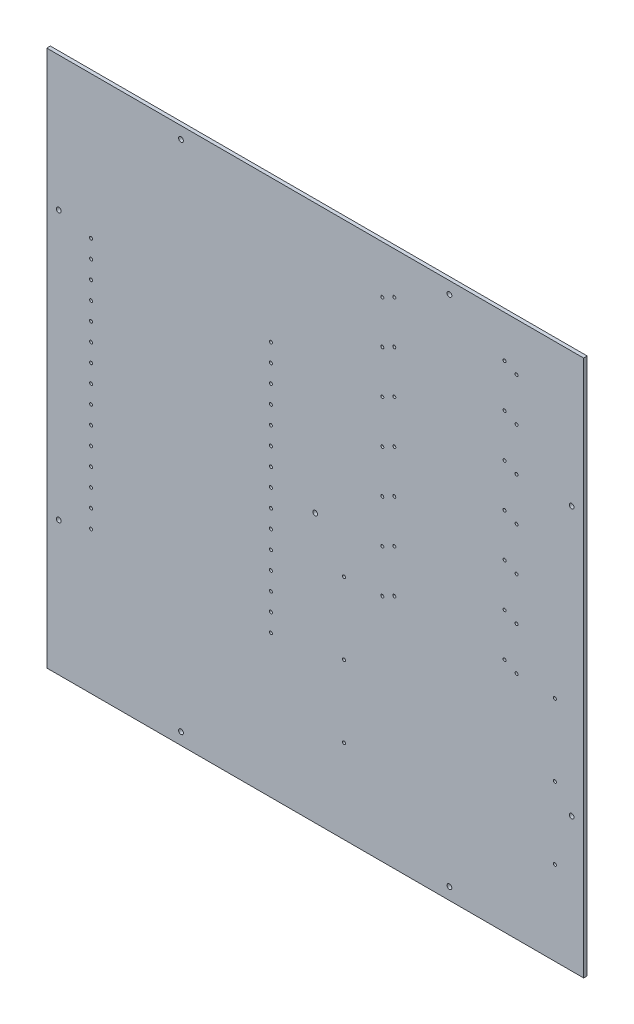
from build123d import *

# Parameters (mm, degrees)
SCHIZZO1_W                   = 448
SCHIZZO1_H                   = 448
SCHIZZO1_R                   = 2
SCHIZZO1_R_2                 = 1.25
ESTRUSIONE_ESTRUSIONE1_DEPTH = 3


with BuildPart() as part:
    # Schizzo1 → Estrusione-Estrusione1 (new body)
    with BuildSketch(Plane.XY):
        with Locations((224, 224)):
            Rectangle(SCHIZZO1_W, SCHIZZO1_H)
        with Locations((10, 336)):
            Circle(SCHIZZO1_R, mode=Mode.SUBTRACT)
        with Locations(Location((336, 438, 0), (0, 0, 180))):
            Circle(SCHIZZO1_R, mode=Mode.SUBTRACT)
        with Locations(Location((438, 336, 0), (0, 0, 180))):
            Circle(SCHIZZO1_R, mode=Mode.SUBTRACT)
        with Locations((438, 112)):
            Circle(SCHIZZO1_R, mode=Mode.SUBTRACT)
        with Locations((336, 10)):
            Circle(SCHIZZO1_R, mode=Mode.SUBTRACT)
        with Locations(Location((112, 10, 0), (0, 0, 180))):
            Circle(SCHIZZO1_R, mode=Mode.SUBTRACT)
        with Locations(Location((10, 112, 0), (0, 0, 180))):
            Circle(SCHIZZO1_R, mode=Mode.SUBTRACT)
        with Locations((36.958788995, 224)):
            Circle(SCHIZZO1_R_2, mode=Mode.SUBTRACT)
        with Locations((112, 438)):
            Circle(SCHIZZO1_R, mode=Mode.SUBTRACT)
        with Locations((36.958788995, 239)):
            Circle(SCHIZZO1_R_2, mode=Mode.SUBTRACT)
        with Locations((36.958788995, 254)):
            Circle(SCHIZZO1_R_2, mode=Mode.SUBTRACT)
        with Locations((36.958788995, 269)):
            Circle(SCHIZZO1_R_2, mode=Mode.SUBTRACT)
        with Locations((36.958788995, 284)):
            Circle(SCHIZZO1_R_2, mode=Mode.SUBTRACT)
        with Locations((36.958788995, 299)):
            Circle(SCHIZZO1_R_2, mode=Mode.SUBTRACT)
        with Locations((36.958788995, 314)):
            Circle(SCHIZZO1_R_2, mode=Mode.SUBTRACT)
        with Locations((36.958788995, 329)):
            Circle(SCHIZZO1_R_2, mode=Mode.SUBTRACT)
        with Locations((248, 70)):
            Circle(SCHIZZO1_R_2, mode=Mode.SUBTRACT)
        with Locations((248, 130)):
            Circle(SCHIZZO1_R_2, mode=Mode.SUBTRACT)
        with Locations((424, 130)):
            Circle(SCHIZZO1_R_2, mode=Mode.SUBTRACT)
        with Locations((424, 70)):
            Circle(SCHIZZO1_R_2, mode=Mode.SUBTRACT)
        with Locations((290, 413)):
            Circle(SCHIZZO1_R_2, mode=Mode.SUBTRACT)
        with Locations((280, 408)):
            Circle(SCHIZZO1_R_2, mode=Mode.SUBTRACT)
        with Locations(Location((392, 408, 0), (0, 0, 180))):
            Circle(SCHIZZO1_R_2, mode=Mode.SUBTRACT)
        with Locations(Location((382, 413, 0), (0, 0, 180))):
            Circle(SCHIZZO1_R_2, mode=Mode.SUBTRACT)
        with Locations((290, 377)):
            Circle(SCHIZZO1_R_2, mode=Mode.SUBTRACT)
        with Locations((280, 372)):
            Circle(SCHIZZO1_R_2, mode=Mode.SUBTRACT)
        with Locations(Location((392, 372, 0), (0, 0, 180))):
            Circle(SCHIZZO1_R_2, mode=Mode.SUBTRACT)
        with Locations(Location((382, 377, 0), (0, 0, 180))):
            Circle(SCHIZZO1_R_2, mode=Mode.SUBTRACT)
        with Locations((290, 341)):
            Circle(SCHIZZO1_R_2, mode=Mode.SUBTRACT)
        with Locations((280, 336)):
            Circle(SCHIZZO1_R_2, mode=Mode.SUBTRACT)
        with Locations(Location((392, 336, 0), (0, 0, 180))):
            Circle(SCHIZZO1_R_2, mode=Mode.SUBTRACT)
        with Locations(Location((382, 341, 0), (0, 0, 180))):
            Circle(SCHIZZO1_R_2, mode=Mode.SUBTRACT)
        with Locations((290, 305)):
            Circle(SCHIZZO1_R_2, mode=Mode.SUBTRACT)
        with Locations((280, 300)):
            Circle(SCHIZZO1_R_2, mode=Mode.SUBTRACT)
        with Locations(Location((392, 300, 0), (0, 0, 180))):
            Circle(SCHIZZO1_R_2, mode=Mode.SUBTRACT)
        with Locations(Location((382, 305, 0), (0, 0, 180))):
            Circle(SCHIZZO1_R_2, mode=Mode.SUBTRACT)
        with Locations((290, 269)):
            Circle(SCHIZZO1_R_2, mode=Mode.SUBTRACT)
        with Locations((280, 264)):
            Circle(SCHIZZO1_R_2, mode=Mode.SUBTRACT)
        with Locations(Location((392, 264, 0), (0, 0, 180))):
            Circle(SCHIZZO1_R_2, mode=Mode.SUBTRACT)
        with Locations(Location((382, 269, 0), (0, 0, 180))):
            Circle(SCHIZZO1_R_2, mode=Mode.SUBTRACT)
        with Locations((290, 233)):
            Circle(SCHIZZO1_R_2, mode=Mode.SUBTRACT)
        with Locations((280, 228)):
            Circle(SCHIZZO1_R_2, mode=Mode.SUBTRACT)
        with Locations(Location((392, 228, 0), (0, 0, 180))):
            Circle(SCHIZZO1_R_2, mode=Mode.SUBTRACT)
        with Locations(Location((382, 233, 0), (0, 0, 180))):
            Circle(SCHIZZO1_R_2, mode=Mode.SUBTRACT)
        with Locations((290, 197)):
            Circle(SCHIZZO1_R_2, mode=Mode.SUBTRACT)
        with Locations((280, 192)):
            Circle(SCHIZZO1_R_2, mode=Mode.SUBTRACT)
        with Locations(Location((392, 192, 0), (0, 0, 180))):
            Circle(SCHIZZO1_R_2, mode=Mode.SUBTRACT)
        with Locations(Location((382, 197, 0), (0, 0, 180))):
            Circle(SCHIZZO1_R_2, mode=Mode.SUBTRACT)
        with Locations(Location((36.958788995, 119, 0), (0, 0, 180))):
            Circle(SCHIZZO1_R_2, mode=Mode.SUBTRACT)
        with Locations(Location((36.958788995, 134, 0), (0, 0, 180))):
            Circle(SCHIZZO1_R_2, mode=Mode.SUBTRACT)
        with Locations(Location((36.958788995, 149, 0), (0, 0, 180))):
            Circle(SCHIZZO1_R_2, mode=Mode.SUBTRACT)
        with Locations(Location((36.958788995, 164, 0), (0, 0, 180))):
            Circle(SCHIZZO1_R_2, mode=Mode.SUBTRACT)
        with Locations(Location((36.958788995, 179, 0), (0, 0, 180))):
            Circle(SCHIZZO1_R_2, mode=Mode.SUBTRACT)
        with Locations(Location((36.958788995, 194, 0), (0, 0, 180))):
            Circle(SCHIZZO1_R_2, mode=Mode.SUBTRACT)
        with Locations(Location((36.958788995, 209, 0), (0, 0, 180))):
            Circle(SCHIZZO1_R_2, mode=Mode.SUBTRACT)
        with Locations((187.041211005, 209)):
            Circle(SCHIZZO1_R_2, mode=Mode.SUBTRACT)
        with Locations((187.041211005, 194)):
            Circle(SCHIZZO1_R_2, mode=Mode.SUBTRACT)
        with Locations((187.041211005, 179)):
            Circle(SCHIZZO1_R_2, mode=Mode.SUBTRACT)
        with Locations((187.041211005, 164)):
            Circle(SCHIZZO1_R_2, mode=Mode.SUBTRACT)
        with Locations((187.041211005, 149)):
            Circle(SCHIZZO1_R_2, mode=Mode.SUBTRACT)
        with Locations((187.041211005, 134)):
            Circle(SCHIZZO1_R_2, mode=Mode.SUBTRACT)
        with Locations((187.041211005, 119)):
            Circle(SCHIZZO1_R_2, mode=Mode.SUBTRACT)
        with Locations(Location((187.041211005, 329, 0), (0, 0, 180))):
            Circle(SCHIZZO1_R_2, mode=Mode.SUBTRACT)
        with Locations(Location((187.041211005, 314, 0), (0, 0, 180))):
            Circle(SCHIZZO1_R_2, mode=Mode.SUBTRACT)
        with Locations(Location((187.041211005, 299, 0), (0, 0, 180))):
            Circle(SCHIZZO1_R_2, mode=Mode.SUBTRACT)
        with Locations(Location((187.041211005, 284, 0), (0, 0, 180))):
            Circle(SCHIZZO1_R_2, mode=Mode.SUBTRACT)
        with Locations(Location((187.041211005, 269, 0), (0, 0, 180))):
            Circle(SCHIZZO1_R_2, mode=Mode.SUBTRACT)
        with Locations(Location((187.041211005, 254, 0), (0, 0, 180))):
            Circle(SCHIZZO1_R_2, mode=Mode.SUBTRACT)
        with Locations(Location((187.041211005, 239, 0), (0, 0, 180))):
            Circle(SCHIZZO1_R_2, mode=Mode.SUBTRACT)
        with Locations(Location((187.041211005, 224, 0), (0, 0, 180))):
            Circle(SCHIZZO1_R_2, mode=Mode.SUBTRACT)
        with Locations((224, 224)):
            Circle(SCHIZZO1_R, mode=Mode.SUBTRACT)
        with Locations(Location((424, 190, 0), (0, 0, 180))):
            Circle(SCHIZZO1_R_2, mode=Mode.SUBTRACT)
        with Locations(Location((248, 190, 0), (0, 0, 180))):
            Circle(SCHIZZO1_R_2, mode=Mode.SUBTRACT)
    extrude(amount=-ESTRUSIONE_ESTRUSIONE1_DEPTH)


solid = part.part
